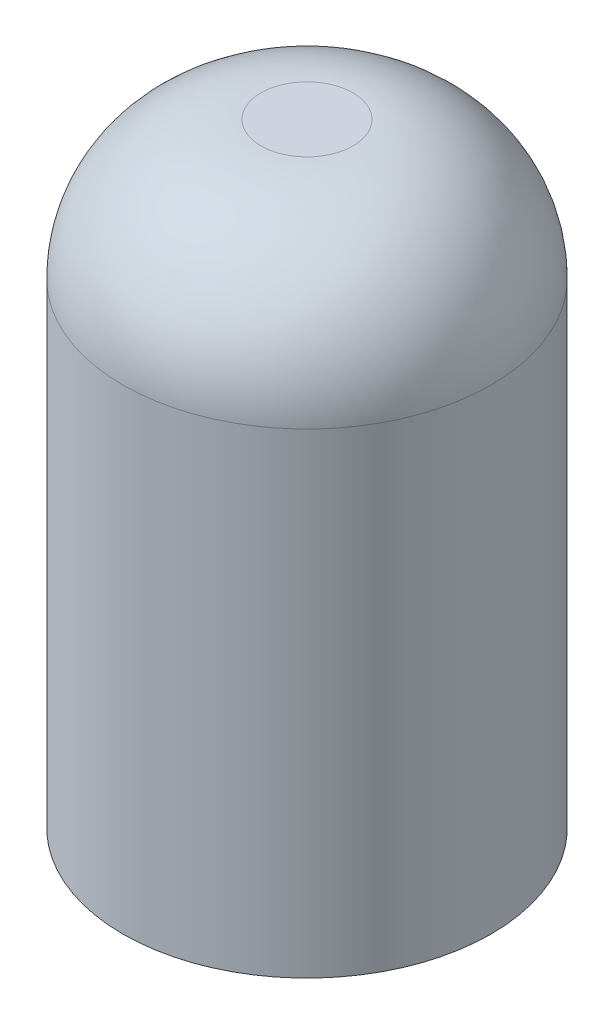
from build123d import *

# Parameters (mm, degrees)
SHELL3_T = -2


with BuildPart() as part:
    # Sketch1 → Revolve3 (revolve)
    with BuildSketch(Plane.XY, mode=Mode.PRIVATE) as revolve3_sk:
        with BuildLine():
            Line((0, 0), (60, 0))
            Line((60, 0), (60, 155))
            ThreePointArc((60, 155), (46.819805153, 186.819805153), (15, 200))
            Line((15, 200), (0, 200))
            Line((0, 200), (0, 0))
        make_face()
    revolve(revolve3_sk.sketch.rotate(Axis((0, 200, 0), (0, -1, 0)), 180), axis=Axis((0, 200, 0), (0, -1, 0)))

    # Shell3
    shell3_openings = [part.faces().sort_by_distance(p)[0] for p in [
        (0, 0, 0),
    ]]
    offset(amount=SHELL3_T, openings=shell3_openings, kind=Kind.INTERSECTION)


solid = part.part
